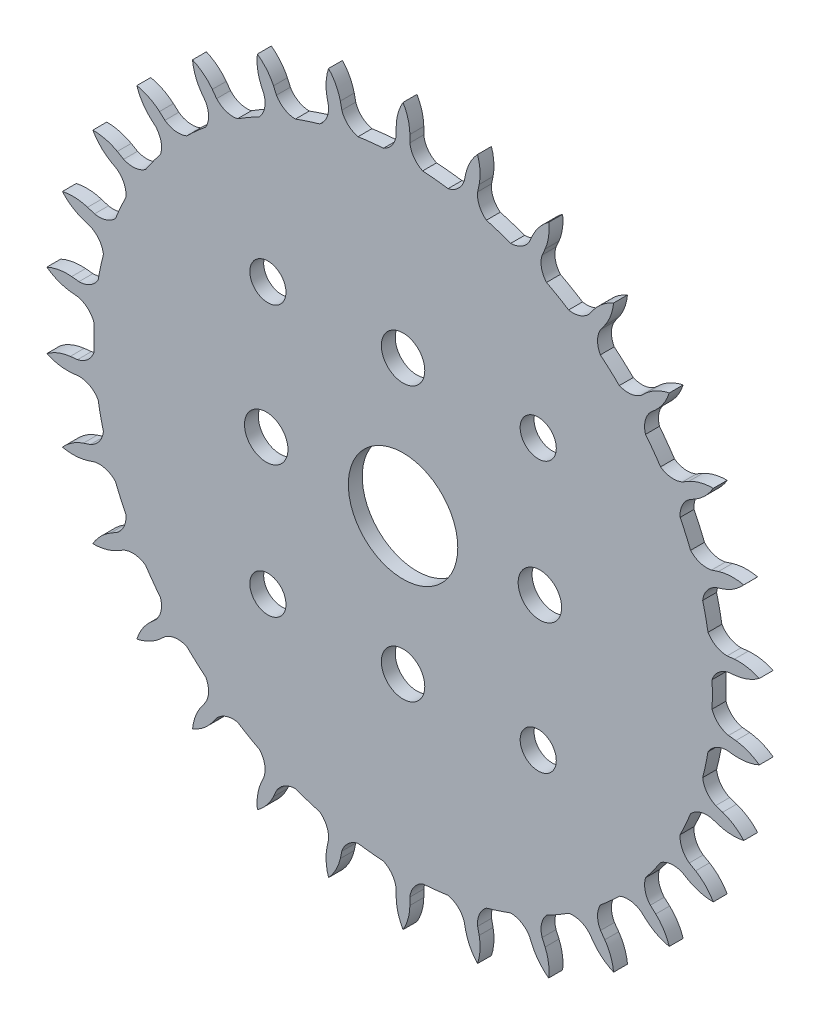
from build123d import *

# Parameters (mm, degrees)
SKETCH1_R           = 22.6042
SKETCH1_R_2         = 1.5875
SKETCH1_R_3         = 1.3208
SKETCH1_R_4         = 4
BOSS_EXTRUDE2_DEPTH = 1.016
BOSS_EXTRUDE4_DEPTH = 1.016
CIRPATTERN1_COUNT   = 30


with BuildPart() as part:
    # Sketch1 → Boss-Extrude2 (new body)
    with BuildSketch(Plane.XY):
        Circle(SKETCH1_R)
        with Locations((0, 10)):
            Circle(SKETCH1_R_2, mode=Mode.SUBTRACT)
        with Locations((9.878281733, -9.878281733)):
            Circle(SKETCH1_R_3, mode=Mode.SUBTRACT)
        with Locations((9.878281733, 9.878281733)):
            Circle(SKETCH1_R_3, mode=Mode.SUBTRACT)
        with Locations((-9.878281733, -9.878281733)):
            Circle(SKETCH1_R_3, mode=Mode.SUBTRACT)
        with Locations((-9.878281733, 9.878281733)):
            Circle(SKETCH1_R_3, mode=Mode.SUBTRACT)
        Circle(SKETCH1_R_4, mode=Mode.SUBTRACT)
        with Locations((10, 0)):
            Circle(SKETCH1_R_2, mode=Mode.SUBTRACT)
        with Locations((0, -10)):
            Circle(SKETCH1_R_2, mode=Mode.SUBTRACT)
        with Locations((-10, 0)):
            Circle(SKETCH1_R_2, mode=Mode.SUBTRACT)
    extrude(amount=BOSS_EXTRUDE2_DEPTH)

    # Sketch2 → Boss-Extrude4 (add)
    with BuildSketch(Plane.XY.offset(1.016)):
        with BuildLine():
            Line((-0.499962578, 23.867964213), (-0.499962578, 24.401364213))
            ThreePointArc((-0.499962578, 24.401364213), (-0.363993462, 25.322423729), (0, 26.179364213))
            ThreePointArc((0, 26.179364213), (0.363993462, 25.322423729), (0.499962578, 24.401364213))
            Line((0.499962578, 24.401364213), (0.499962578, 23.867964213))
            ThreePointArc((0.499962578, 23.867964213), (0.860362618, 23.002073844), (1.639119464, 22.479396033))
            ThreePointArc((1.639119464, 22.479396033), (0, 22.249732232), (-1.639119464, 22.479396033))
            ThreePointArc((-1.639119464, 22.479396033), (-0.860362618, 23.002073844), (-0.499962578, 23.867964213))
        make_face()
    boss_extrude4 = extrude(amount=-BOSS_EXTRUDE4_DEPTH)

    # CirPattern1: Boss-Extrude4 ×30 about axis
    cirpattern1_axis = Axis((0, 0, 0), (0, 0, 1))
    for i in range(1, CIRPATTERN1_COUNT):
        add(boss_extrude4.rotate(cirpattern1_axis, i * 360 / CIRPATTERN1_COUNT))


solid = part.part
